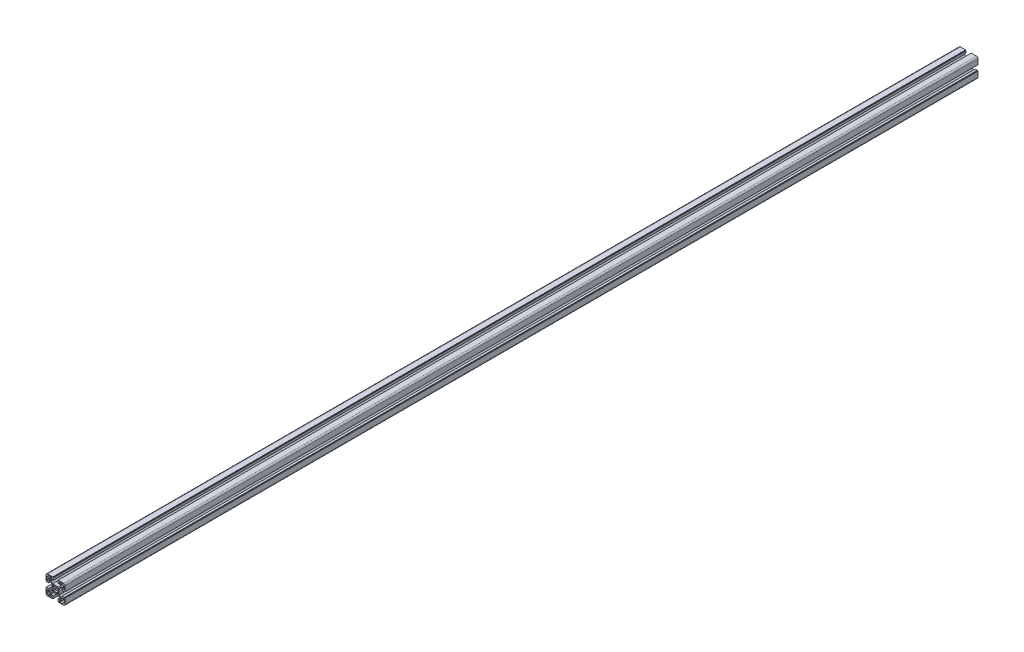
from build123d import *

# Parameters (mm, degrees)
EXTRUDE1_DEPTH = 1920


with BuildPart() as part:
    # Sketch1 → Extrude1 (new body)
    with BuildSketch(Plane.XY):
        with BuildLine():
            Line((5.8, -20), (17, -20))
            ThreePointArc((17, -20), (19.121320344, -19.121320344), (20, -17))
            Line((20, -17), (20, -5.8))
            Line((20, -5.8), (18.5, -5.8))
            Line((18.5, -5.8), (18.5, -5))
            Line((18.5, -5), (14, -5))
            Line((14, -5), (14, -10.05))
            Line((14, -10.05), (11.464213562, -10.05))
            Line((11.464213562, -10.05), (7.5, -6.085786438))
            Line((7.5, -6.085786438), (7.5, 6.085786438))
            Line((7.5, 6.085786438), (11.464213562, 10.05))
            Line((11.464213562, 10.05), (14, 10.05))
            Line((14, 10.05), (14, 5))
            Line((14, 5), (18.5, 5))
            Line((18.5, 5), (18.5, 5.8))
            Line((18.5, 5.8), (20, 5.8))
            Line((20, 5.8), (20, 17))
            ThreePointArc((20, 17), (19.121320344, 19.121320344), (17, 20))
            Line((17, 20), (5.8, 20))
            Line((5.8, 20), (5.8, 18.5))
            Line((5.8, 18.5), (5, 18.5))
            Line((5, 18.5), (5, 14))
            Line((5, 14), (10.05, 14))
            Line((10.05, 14), (10.05, 11.464213562))
            Line((10.05, 11.464213562), (6.085786438, 7.5))
            Line((6.085786438, 7.5), (-6.085786438, 7.5))
            Line((-6.085786438, 7.5), (-10.05, 11.464213562))
            Line((-10.05, 11.464213562), (-10.05, 14))
            Line((-10.05, 14), (-5, 14))
            Line((-5, 14), (-5, 18.5))
            Line((-5, 18.5), (-5.8, 18.5))
            Line((-5.8, 18.5), (-5.8, 20))
            Line((-5.8, 20), (-17, 20))
            ThreePointArc((-17, 20), (-19.121320344, 19.121320344), (-20, 17))
            Line((-20, 17), (-20, 5.8))
            Line((-20, 5.8), (-18.5, 5.8))
            Line((-18.5, 5.8), (-18.5, 5))
            Line((-18.5, 5), (-14, 5))
            Line((-14, 5), (-14, 10.05))
            Line((-14, 10.05), (-11.464213562, 10.05))
            Line((-11.464213562, 10.05), (-7.5, 6.085786438))
            Line((-7.5, 6.085786438), (-7.5, -6.085786438))
            Line((-7.5, -6.085786438), (-11.464213562, -10.05))
            Line((-11.464213562, -10.05), (-14, -10.05))
            Line((-14, -10.05), (-14, -5))
            Line((-14, -5), (-18.5, -5))
            Line((-18.5, -5), (-18.5, -5.8))
            Line((-18.5, -5.8), (-20, -5.8))
            Line((-20, -5.8), (-20, -17))
            ThreePointArc((-20, -17), (-19.121320344, -19.121320344), (-17, -20))
            Line((-17, -20), (-5.8, -20))
            Line((-5.8, -20), (-5.8, -18.5))
            Line((-5.8, -18.5), (-5, -18.5))
            Line((-5, -18.5), (-5, -14))
            Line((-5, -14), (-10.05, -14))
            Line((-10.05, -14), (-10.05, -11.464213562))
            Line((-10.05, -11.464213562), (-6.085786438, -7.5))
            Line((-6.085786438, -7.5), (6.085786438, -7.5))
            Line((6.085786438, -7.5), (10.05, -11.464213562))
            Line((10.05, -11.464213562), (10.05, -14))
            Line((10.05, -14), (5, -14))
            Line((5, -14), (5, -18.5))
            Line((5, -18.5), (5.8, -18.5))
            Line((5.8, -18.5), (5.8, -20))
        make_face()
        with BuildLine():
            Line((14.5, -18.5), (9.5, -18.5))
            ThreePointArc((9.5, -18.5), (8, -17), (9.5, -15.5))
            Line((9.5, -15.5), (11.75, -15.5))
            Line((11.75, -15.5), (11.75, -14.5))
            ThreePointArc((11.75, -14.5), (12.555456352, -12.555456352), (14.5, -11.75))
            Line((14.5, -11.75), (15.5, -11.75))
            Line((15.5, -11.75), (15.5, -9.5))
            ThreePointArc((15.5, -9.5), (17, -8), (18.5, -9.5))
            Line((18.5, -9.5), (18.5, -14.5))
            Line((18.5, -14.5), (17.25, -14.5))
            ThreePointArc((17.25, -14.5), (16.444543648, -16.444543648), (14.5, -17.25))
            Line((14.5, -17.25), (14.5, -18.5))
        make_face(mode=Mode.SUBTRACT)
        with BuildLine():
            Line((18.5, 14.5), (17.25, 14.5))
            ThreePointArc((17.25, 14.5), (16.444543648, 16.444543648), (14.5, 17.25))
            Line((14.5, 17.25), (14.5, 18.5))
            Line((14.5, 18.5), (9.5, 18.5))
            ThreePointArc((9.5, 18.5), (8, 17), (9.5, 15.5))
            Line((9.5, 15.5), (11.75, 15.5))
            Line((11.75, 15.5), (11.75, 14.5))
            ThreePointArc((11.75, 14.5), (12.555456352, 12.555456352), (14.5, 11.75))
            Line((14.5, 11.75), (15.5, 11.75))
            Line((15.5, 11.75), (15.5, 9.5))
            ThreePointArc((15.5, 9.5), (17, 8), (18.5, 9.5))
            Line((18.5, 9.5), (18.5, 14.5))
        make_face(mode=Mode.SUBTRACT)
        with BuildLine():
            Line((5.5, 5.5), (2.397915762, 5.5))
            Line((2.397915762, 5.5), (1.998263135, 4.583333333))
            ThreePointArc((1.998263135, 4.583333333), (0, 5), (-1.998263135, 4.583333333))
            Line((-1.998263135, 4.583333333), (-2.397915762, 5.5))
            Line((-2.397915762, 5.5), (-5.5, 5.5))
            Line((-5.5, 5.5), (-5.5, 2.397915762))
            Line((-5.5, 2.397915762), (-4.583333333, 1.998263135))
            ThreePointArc((-4.583333333, 1.998263135), (-5, 0), (-4.583333333, -1.998263135))
            Line((-4.583333333, -1.998263135), (-5.5, -2.397915762))
            Line((-5.5, -2.397915762), (-5.5, -5.5))
            Line((-5.5, -5.5), (-2.397915762, -5.5))
            Line((-2.397915762, -5.5), (-1.998263135, -4.583333333))
            ThreePointArc((-1.998263135, -4.583333333), (0, -5), (1.998263135, -4.583333333))
            Line((1.998263135, -4.583333333), (2.397915762, -5.5))
            Line((2.397915762, -5.5), (5.5, -5.5))
            Line((5.5, -5.5), (5.5, -2.397915762))
            Line((5.5, -2.397915762), (4.583333333, -1.998263135))
            ThreePointArc((4.583333333, -1.998263135), (5, 0), (4.583333333, 1.998263135))
            Line((4.583333333, 1.998263135), (5.5, 2.397915762))
            Line((5.5, 2.397915762), (5.5, 5.5))
        make_face(mode=Mode.SUBTRACT)
        with BuildLine():
            Line((-18.5, -14.5), (-17.25, -14.5))
            ThreePointArc((-17.25, -14.5), (-16.444543648, -16.444543648), (-14.5, -17.25))
            Line((-14.5, -17.25), (-14.5, -18.5))
            Line((-14.5, -18.5), (-9.5, -18.5))
            ThreePointArc((-9.5, -18.5), (-8, -17), (-9.5, -15.5))
            Line((-9.5, -15.5), (-11.75, -15.5))
            Line((-11.75, -15.5), (-11.75, -14.5))
            ThreePointArc((-11.75, -14.5), (-12.555456352, -12.555456352), (-14.5, -11.75))
            Line((-14.5, -11.75), (-15.5, -11.75))
            Line((-15.5, -11.75), (-15.5, -9.5))
            ThreePointArc((-15.5, -9.5), (-17, -8), (-18.5, -9.5))
            Line((-18.5, -9.5), (-18.5, -14.5))
        make_face(mode=Mode.SUBTRACT)
        with BuildLine():
            Line((-14.5, 18.5), (-9.5, 18.5))
            ThreePointArc((-9.5, 18.5), (-8, 17), (-9.5, 15.5))
            Line((-9.5, 15.5), (-11.75, 15.5))
            Line((-11.75, 15.5), (-11.75, 14.5))
            ThreePointArc((-11.75, 14.5), (-12.555456352, 12.555456352), (-14.5, 11.75))
            Line((-14.5, 11.75), (-15.5, 11.75))
            Line((-15.5, 11.75), (-15.5, 9.5))
            ThreePointArc((-15.5, 9.5), (-17, 8), (-18.5, 9.5))
            Line((-18.5, 9.5), (-18.5, 14.5))
            Line((-18.5, 14.5), (-17.25, 14.5))
            ThreePointArc((-17.25, 14.5), (-16.444543648, 16.444543648), (-14.5, 17.25))
            Line((-14.5, 17.25), (-14.5, 18.5))
        make_face(mode=Mode.SUBTRACT)
    extrude(amount=EXTRUDE1_DEPTH)


solid = part.part
